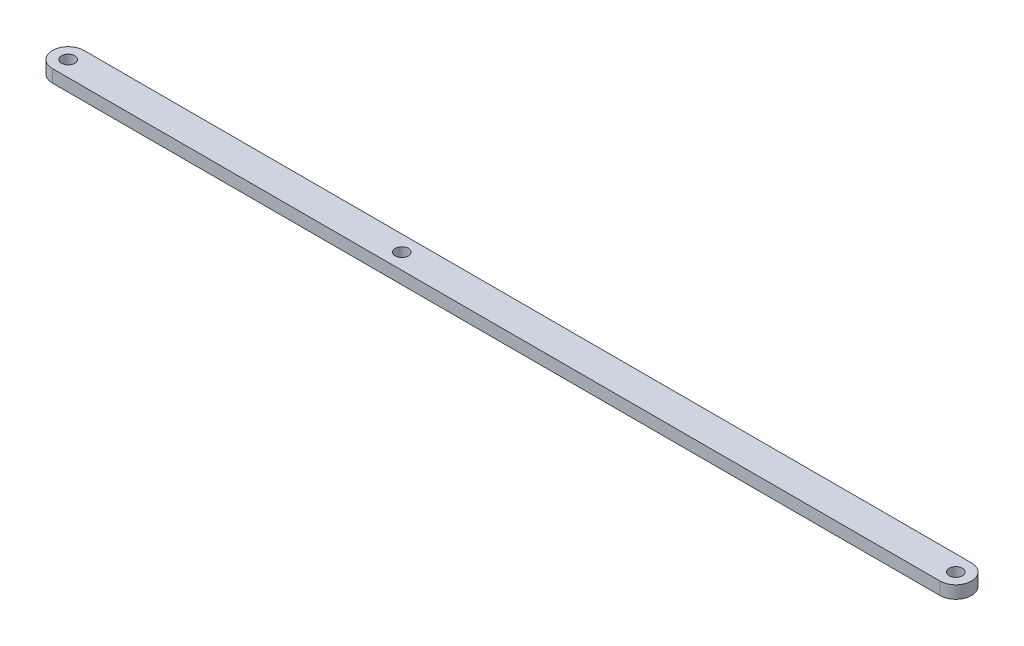
from build123d import *

# Parameters (mm, degrees)
SKETCH1_R           = 1.05
BOSS_EXTRUDE1_DEPTH = 2


with BuildPart() as part:
    # Sketch1 → Boss-Extrude1 (new body)
    with BuildSketch(Plane(origin=(0, 0, 0), x_dir=(1, 0, 0), z_dir=(0, 1, 0))):
        with BuildLine():
            Line((0, 2.5), (141, 2.5))
            ThreePointArc((141, 2.5), (143.5, 0), (141, -2.5))
            Line((141, -2.5), (0, -2.5))
            ThreePointArc((0, -2.5), (-2.5, 0), (0, 2.5))
        make_face()
        with Locations(Location((0, 0, 0), (0, 0, 270))):
            Circle(SKETCH1_R, mode=Mode.SUBTRACT)
        with Locations(Location((141, 0, 0), (0, 0, 270))):
            Circle(SKETCH1_R, mode=Mode.SUBTRACT)
        with Locations(Location((53, 0, 0), (0, 0, 270))):
            Circle(SKETCH1_R, mode=Mode.SUBTRACT)
    extrude(amount=BOSS_EXTRUDE1_DEPTH)


solid = part.part
